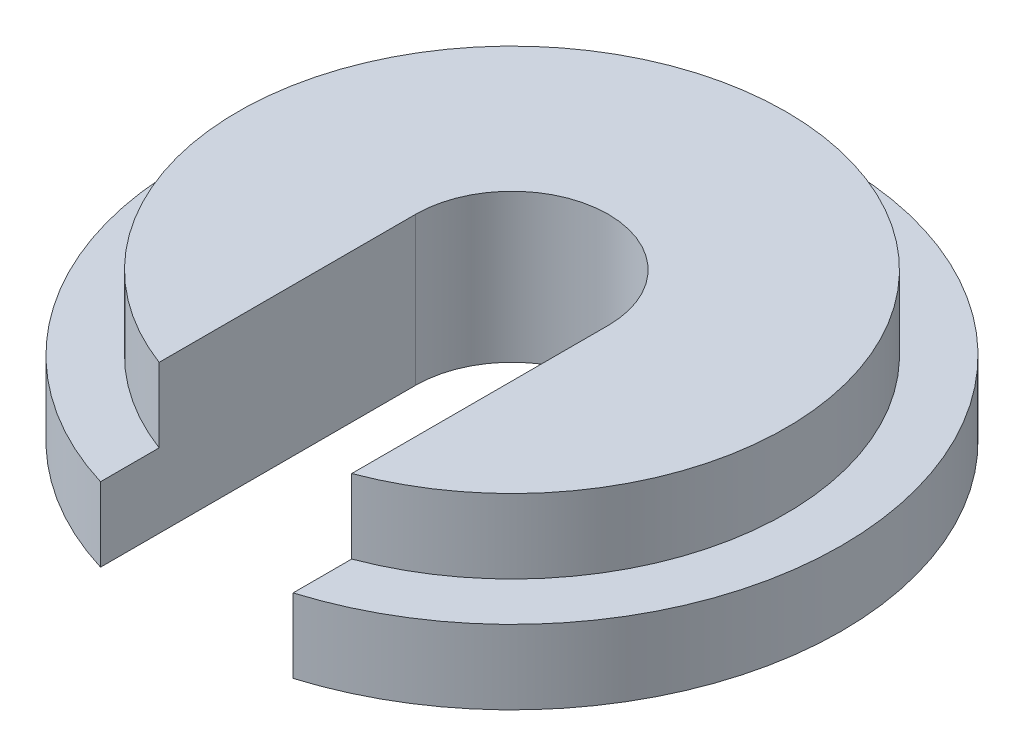
from build123d import *

# Parameters (mm, degrees)
SKETCH1_R           = 44.5
BOSS_EXTRUDE1_DEPTH = 10
SKETCH2_R           = 37
BOSS_EXTRUDE2_DEPTH = 10
CUT_EXTRUDE1_DEPTH  = 67.034082109


with BuildPart() as part:
    # Sketch1 → Boss-Extrude1 (new body)
    with BuildSketch(Plane(origin=(0, 0, 0), x_dir=(1, 0, 0), z_dir=(0, 1, 0))):
        with Locations(Location((0, 0, 0), (0, 0, 270))):
            Circle(SKETCH1_R)
    extrude(amount=BOSS_EXTRUDE1_DEPTH)

    # Sketch2 → Boss-Extrude2 (add)
    with BuildSketch(Plane(origin=(0, 10, 0), x_dir=(1, 0, 0), z_dir=(0, 1, 0))):
        with Locations(Location((0, 0, 0), (0, 0, 270))):
            Circle(SKETCH2_R)
    extrude(amount=BOSS_EXTRUDE2_DEPTH)

    # Sketch3 → Cut-Extrude1 (cut, through all)
    with BuildSketch(Plane.XZ):
        with BuildLine():
            Line((-13, 0), (-13, 42.558782877))
            Line((-13, 42.558782877), (-13, 62.217124748))
            Line((-13, 62.217124748), (13, 62.217124748))
            Line((13, 62.217124748), (13, 0))
            ThreePointArc((13, 0), (0, -13), (-13, 0))
        make_face()
    extrude(amount=-CUT_EXTRUDE1_DEPTH, mode=Mode.SUBTRACT)


solid = part.part
